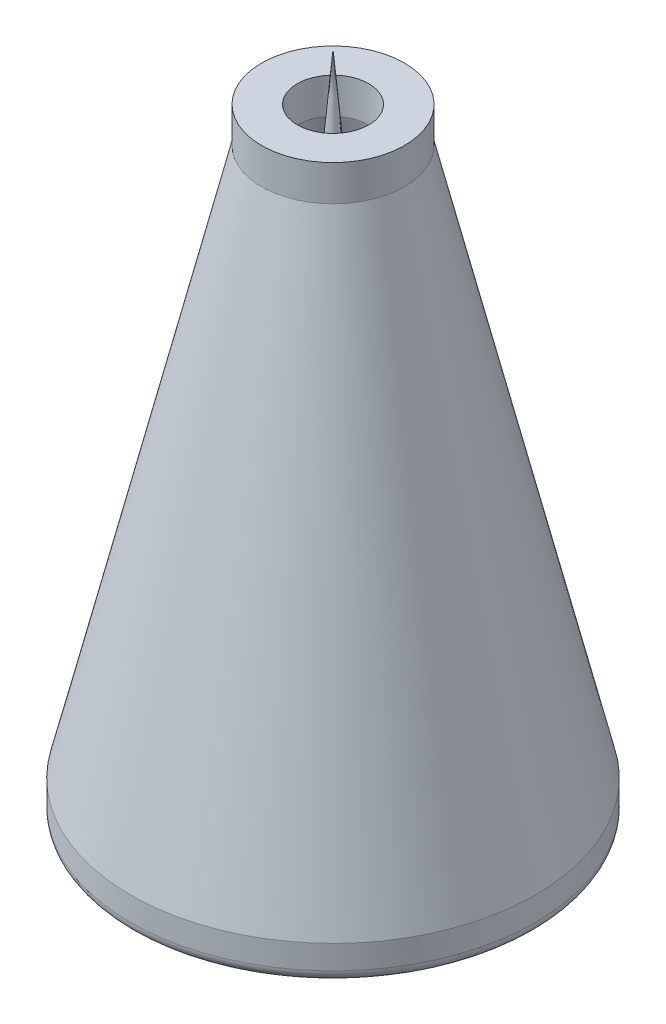
from build123d import *

# Parameters (mm, degrees)
FILLET1_R           = 5
BOSS_EXTRUDE1_REACH = 306.713
CIRPATTERN1_COUNT   = 3


with BuildPart() as part:
    # Sketch1 → Revolve1 (revolve)
    with BuildSketch(Plane.XY, mode=Mode.PRIVATE) as revolve1_sk:
        Polygon((-70, 0), (-85, 0), (-85, 15), (-30, 245), (-30, 260), (-15, 260), (-15, 245), (-70, 15), align=None)
    revolve(revolve1_sk.sketch.rotate(Axis((0, 0, 0), (0, 1, 0)), 270), axis=Axis((0, 0, 0), (0, 1, 0)))

    # Fillet1
    fillet1_edges = [part.edges().sort_by_distance(p)[0] for p in [
        (0, 0, 70),
        (0, 0, 85),
    ]]
    fillet(fillet1_edges, radius=FILLET1_R)



with BuildPart() as body_2:
    # Sketch3 → Revolve2 (revolve)
    with BuildSketch(Plane.XY, mode=Mode.PRIVATE) as revolve2_sk:
        with BuildLine():
            Line((0, 30), (0, 280))
            Line((0, 280), (-20, 50))
            ThreePointArc((-20, 50), (-14.142135624, 35.857864376), (0, 30))
        make_face()
    revolve(revolve2_sk.sketch.rotate(Axis((0, 50, 0), (0, 1, 0)), 90), axis=Axis((0, 50, 0), (0, 1, 0)))


with BuildPart() as part_1:
    add(part.part)

    add(body_2.part)  # Boss-Extrude1 merges body 2
    # Boss-Extrude1: up to this cone (the profile starts inside it)
    boss_extrude1_end = Plane(origin=(0, 102, 0), z_dir=(0, -1, 0)).offset(-205.727271727) * Cone(1e-06, 134.423808129, 562.135923901, align=(Align.CENTER, Align.CENTER, Align.MIN), mode=Mode.PRIVATE)
    # Sketch5 → Boss-Extrude1 (add, up to the surface)
    with BuildSketch(Plane(origin=(0, 0, 0), x_dir=(0, 0, -1), z_dir=(1, 0, 0)), mode=Mode.PRIVATE) as boss_extrude1_sk1:
        with BuildLine():
            Line((-1, 62), (1, 62))
            ThreePointArc((1, 62), (4.535533906, 63.464466094), (6, 67))
            Line((6, 67), (6, 137))
            ThreePointArc((6, 137), (4.535533906, 140.535533906), (1, 142))
            Line((1, 142), (-1, 142))
            ThreePointArc((-1, 142), (-4.535533906, 140.535533906), (-6, 137))
            Line((-6, 137), (-6, 67))
            ThreePointArc((-6, 67), (-4.535533906, 63.464466094), (-1, 62))
        make_face()
    boss_extrude1_tool1 = extrude(boss_extrude1_sk1.sketch, amount=BOSS_EXTRUDE1_REACH, mode=Mode.PRIVATE) & boss_extrude1_end
    boss_extrude1 = boss_extrude1_tool1.solids().sort_by_distance((0, 102, 0))[0]
    add(boss_extrude1)

    # CirPattern1: Boss-Extrude1 ×3 about axis
    cirpattern1_axis = Axis((0, 0, 0), (0, 1, 0))
    for i in range(1, CIRPATTERN1_COUNT):
        add(boss_extrude1.rotate(cirpattern1_axis, i * 360 / CIRPATTERN1_COUNT))


solid = part_1.part
